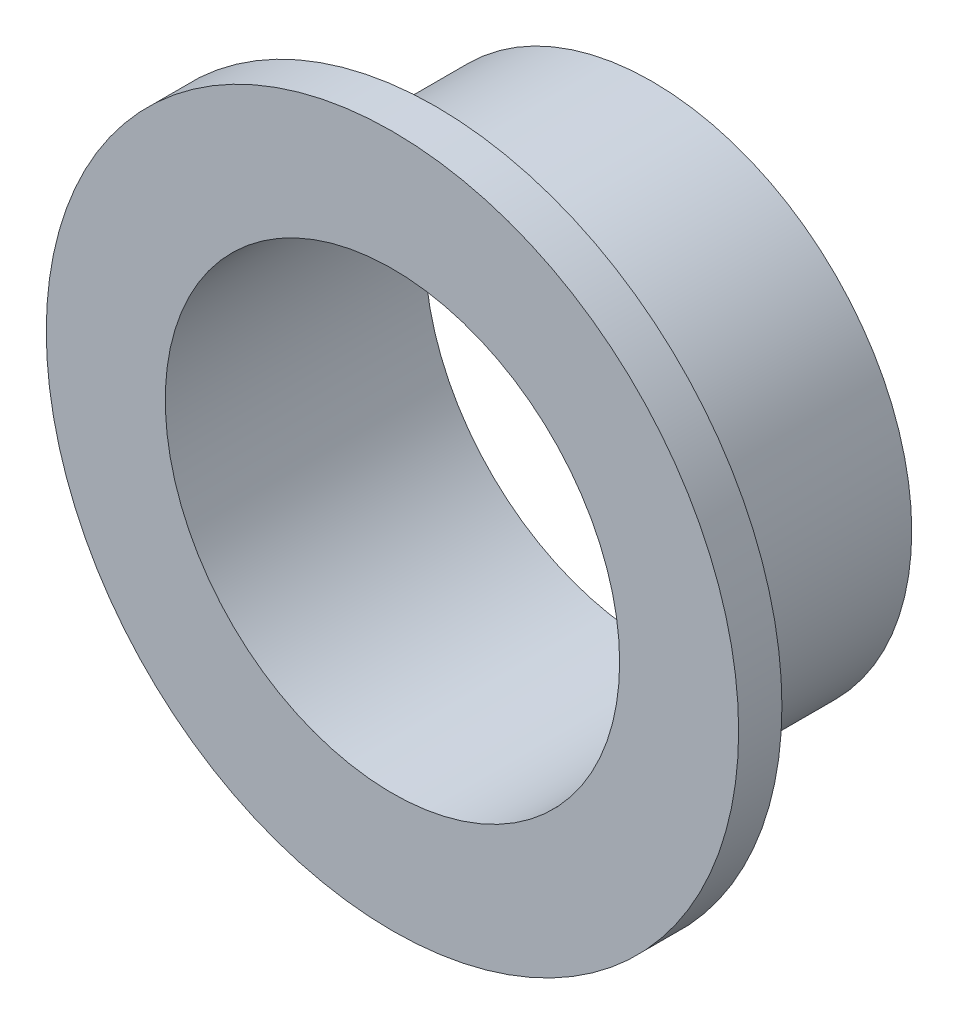
from build123d import *

# Parameters (mm, degrees)
SKETCH_1_R      = 6
SKETCH_1_R_2    = 5.25
EXTRUDE_1_DEPTH = 5
SKETCH_2_R      = 8
SKETCH_2_R_2    = 5.25
EXTRUDE_2_DEPTH = 1


with BuildPart() as part:
    # 草图1 → 凸台-拉伸1 (new body)
    with BuildSketch(Plane.XY):
        Circle(SKETCH_1_R)
        Circle(SKETCH_1_R_2, mode=Mode.SUBTRACT)
    extrude(amount=EXTRUDE_1_DEPTH)

    # 草图2 → 凸台-拉伸2 (add)
    with BuildSketch(Plane.XY.offset(5)):
        Circle(SKETCH_2_R)
        Circle(SKETCH_2_R_2, mode=Mode.SUBTRACT)
    extrude(amount=EXTRUDE_2_DEPTH)


solid = part.part
